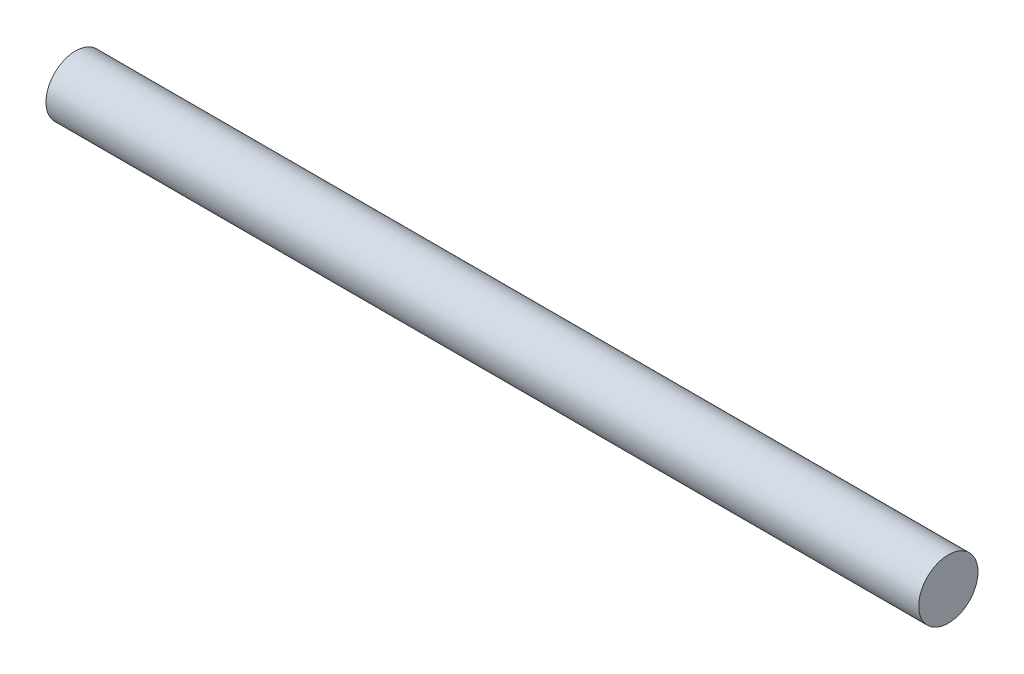
from build123d import *

# Parameters (mm, degrees)
SKETCH1_R           = 1.25
BOSS_EXTRUDE1_DEPTH = 36.8


with BuildPart() as part:
    # Sketch1 → Boss-Extrude1 (new body)
    with BuildSketch(Plane(origin=(0, 0, 0), x_dir=(0, 0, -1), z_dir=(1, 0, 0))):
        Circle(SKETCH1_R)
    extrude(amount=BOSS_EXTRUDE1_DEPTH)


solid = part.part
